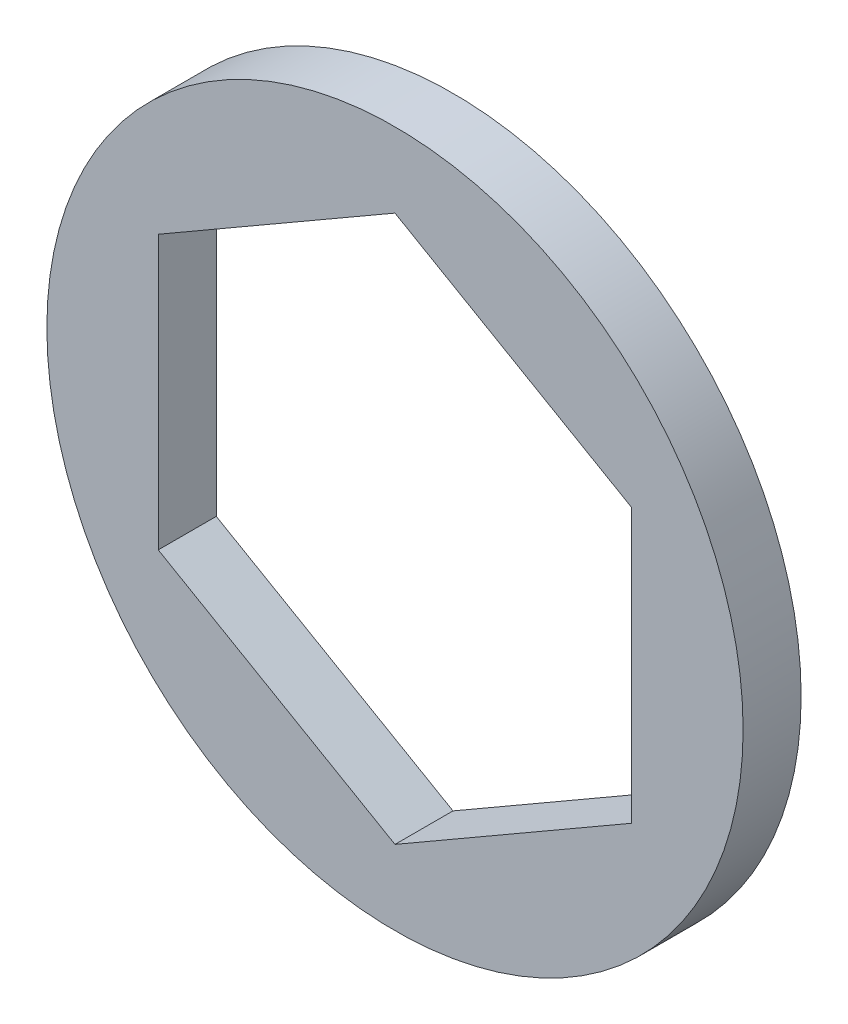
from build123d import *

# Parameters (mm, degrees)
SKETCH1_R           = 9.525
BOSS_EXTRUDE1_DEPTH = 0.79375


with BuildPart() as part:
    # Sketch1 → Boss-Extrude1 (new, symmetric)
    with BuildSketch(Plane.XY):
        Circle(SKETCH1_R)
        Polygon((0, 7.478995387), (-6.477, 3.739497694), (-6.477, -3.739497694), (0, -7.478995387), (6.477, -3.739497694), (6.477, 3.739497694), align=None, mode=Mode.SUBTRACT)
    extrude(amount=BOSS_EXTRUDE1_DEPTH, both=True)


solid = part.part
